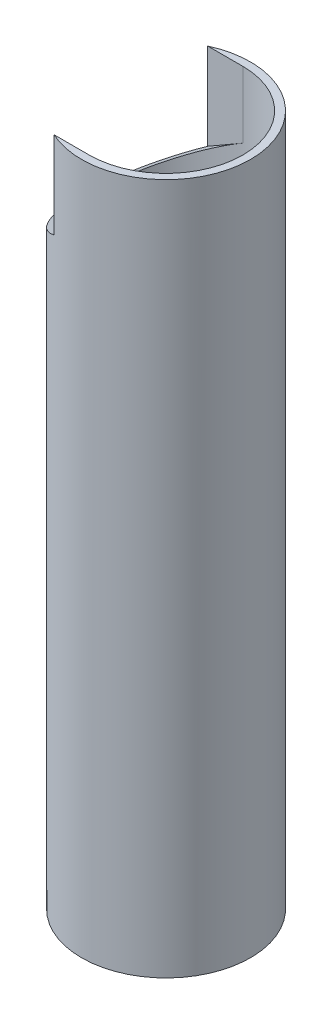
from build123d import *

# Parameters (mm, degrees)
SKETCH1_R           = 22
SKETCH1_R_2         = 20
BOSS_EXTRUDE1_DEPTH = 180
SKETCH3_W           = 30
SKETCH3_H           = 40
CUT_EXTRUDE1_DEPTH  = 63
BOSS_EXTRUDE2_START = 150
BOSS_EXTRUDE2_DEPTH = 30


with BuildPart() as part:
    # Sketch1 → Boss-Extrude1 (new body)
    with BuildSketch(Plane(origin=(0, 0, 0), x_dir=(1, 0, 0), z_dir=(0, 1, 0))):
        with Locations(Location((0, 0, 0), (0, 0, 90))):
            Circle(SKETCH1_R)
        with Locations(Location((0, 0, 0), (0, 0, 90))):
            Circle(SKETCH1_R_2, mode=Mode.SUBTRACT)
    extrude(amount=BOSS_EXTRUDE1_DEPTH)

    # Sketch3 → Cut-Extrude1 (cut)
    with BuildSketch(Plane(origin=(77.942286341, 45, 0), x_dir=(0.5000000000000041, -0.8660254037844362, 0), z_dir=(0.8660254037844363, 0.5000000000000042, 0))):
        with Locations((-155.884572681, 0)):
            Rectangle(SKETCH3_W, SKETCH3_H)
    extrude(amount=-CUT_EXTRUDE1_DEPTH, mode=Mode.SUBTRACT)

    # Sketch1<3> → Boss-Extrude2 (add)
    with BuildSketch(Plane(origin=(0, 0, 0), x_dir=(1, 0, 0), z_dir=(0, 1, 0)).offset(BOSS_EXTRUDE2_START)):
        with BuildLine():
            ThreePointArc((20, 0), (14.142135624, -14.142135624), (0, -20))
            Line((0, -20), (0, -22))
            ThreePointArc((0, -22), (15.556349186, -15.556349186), (22, 0))
            ThreePointArc((22, 0), (15.556349186, 15.556349186), (0, 22))
            Line((0, 22), (0, 20))
            ThreePointArc((0, 20), (14.142135624, 14.142135624), (20, 0))
        make_face()
    extrude(amount=BOSS_EXTRUDE2_DEPTH)


solid = part.part
